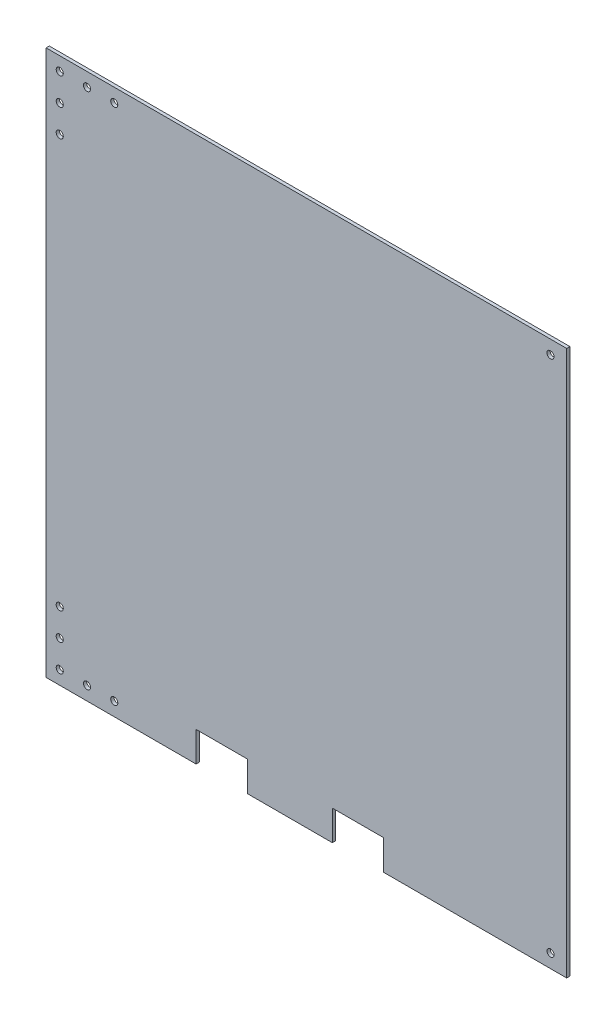
from build123d import *

# Parameters (mm, degrees)
SKETCH1_W           = 485
SKETCH1_H           = 508
BOSS_EXTRUDE1_DEPTH = 3
SKETCH2_R           = 3.295
CUT_EXTRUDE1_DEPTH  = 3
SKETCH3_W           = 47.752
SKETCH3_H           = 27.94
CUT_EXTRUDE2_DEPTH  = 1652.178452636
SKETCH4_R           = 3.302
CUT_EXTRUDE3_DEPTH  = 1652.178452636


with BuildPart() as part:
    # Sketch1 → Boss-Extrude1 (new body)
    with BuildSketch(Plane.XY):
        with Locations((1316.453196618, -290.101289471)):
            Rectangle(SKETCH1_W, SKETCH1_H)
    extrude(amount=BOSS_EXTRUDE1_DEPTH)

    # Sketch2 → Cut-Extrude1 (cut)
    with BuildSketch(Plane.XY.offset(3)):
        with Locations((1086.653196618, -48.801289471)):
            Circle(SKETCH2_R)
        with Locations((1543.853196618, -48.801289471)):
            Circle(SKETCH2_R)
        with Locations((1543.967196618, -531.401289471)):
            Circle(SKETCH2_R)
        with Locations((1086.653196618, -531.401289471)):
            Circle(SKETCH2_R)
    extrude(amount=-CUT_EXTRUDE1_DEPTH, mode=Mode.SUBTRACT)

    # Sketch3 → Cut-Extrude2 (cut, through all)
    with BuildSketch(Plane.XY.offset(3)):
        with Locations((1237.529196618, -530.131289471)):
            Rectangle(SKETCH3_W, SKETCH3_H)
        with Locations((1364.529196618, -530.131289471)):
            Rectangle(SKETCH3_W, SKETCH3_H)
    extrude(amount=-CUT_EXTRUDE2_DEPTH, mode=Mode.SUBTRACT)

    # Sketch4 → Cut-Extrude3 (cut, through all)
    with BuildSketch(Plane.XY.offset(3)):
        with Locations((1112.053196618, -48.801289471)):
            Circle(SKETCH4_R)
        with Locations((1137.453196618, -48.801289471)):
            Circle(SKETCH4_R)
        with Locations((1086.653196618, -74.201289471)):
            Circle(SKETCH4_R)
        with Locations((1086.653196618, -99.601289471)):
            Circle(SKETCH4_R)
        with Locations((1086.653196618, -480.601289471)):
            Circle(SKETCH4_R)
        with Locations((1086.653196618, -506.001289471)):
            Circle(SKETCH4_R)
        with Locations((1112.053196618, -531.401289471)):
            Circle(SKETCH4_R)
        with Locations((1137.453196618, -531.401289471)):
            Circle(SKETCH4_R)
    extrude(amount=-CUT_EXTRUDE3_DEPTH, mode=Mode.SUBTRACT)


solid = part.part
